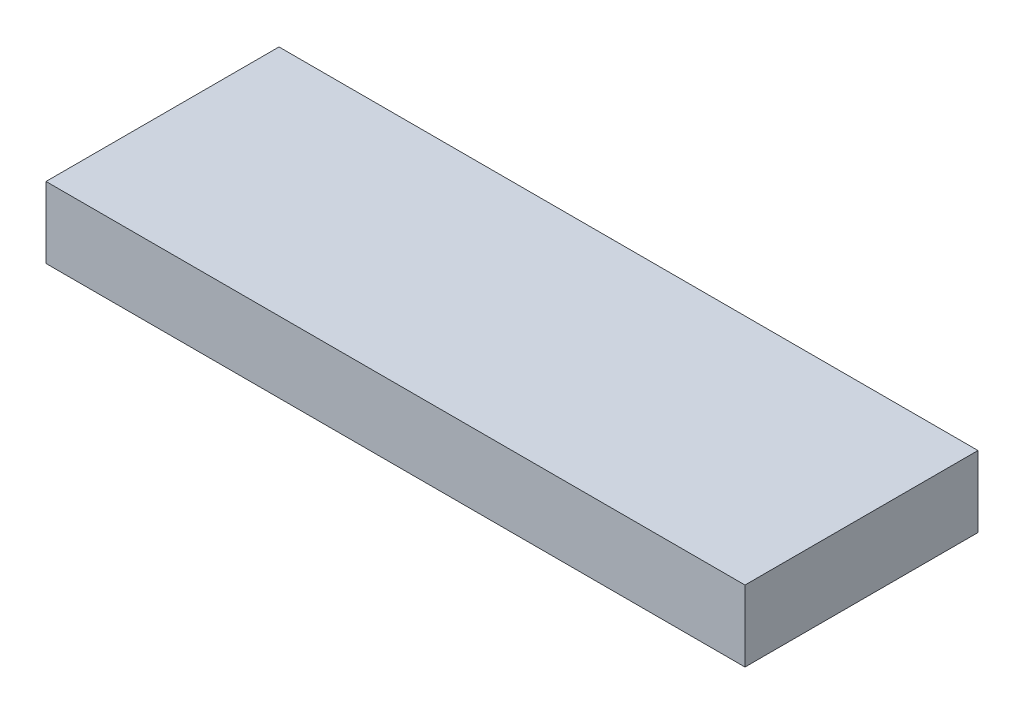
from build123d import *

# Parameters (mm, degrees)
SKETCH1_W           = 76.2
SKETCH1_H           = 25.4
BOSS_EXTRUDE1_DEPTH = 7.747


with BuildPart() as part:
    # Sketch1 → Boss-Extrude1 (new body)
    with BuildSketch(Plane(origin=(0, 0, 0), x_dir=(1, 0, 0), z_dir=(0, 1, 0))):
        with Locations((38.1, 12.7)):
            Rectangle(SKETCH1_W, SKETCH1_H)
    extrude(amount=BOSS_EXTRUDE1_DEPTH)


solid = part.part
